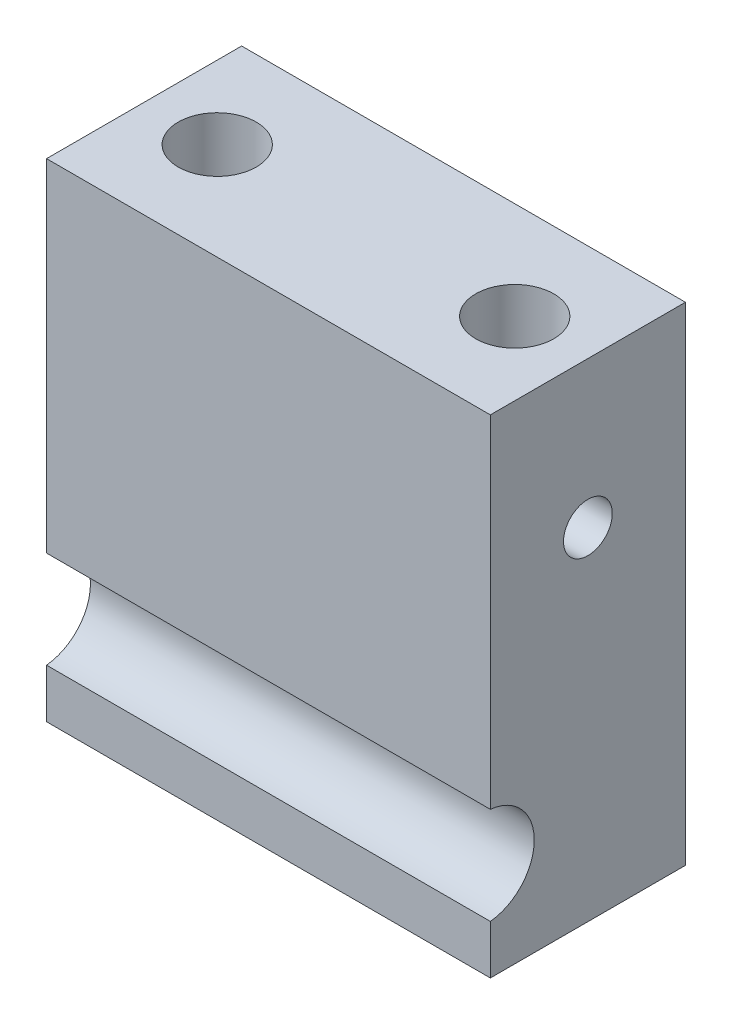
from build123d import *

# Parameters (mm, degrees)
SKETCH_1_W          = 9.1
SKETCH_1_H          = 4
EXTRUDE_1_DEPTH     = 10
SKETCH_2_R          = 0.5
SKETCH_2_R_2        = 1
CUT_EXTRUDE_1_DEPTH = 14.667845478
SKETCH_3_R          = 0.8
CUT_EXTRUDE_2_DEPTH = 2


with BuildPart() as part:
    # 草图1 → 凸台-拉伸1 (new body)
    with BuildSketch(Plane(origin=(0, 0, 0), x_dir=(1, 0, 0), z_dir=(0, 1, 0))):
        Rectangle(SKETCH_1_W, SKETCH_1_H)
    extrude(amount=EXTRUDE_1_DEPTH)

    # 草图2 → 切除-拉伸1 (cut, through all)
    with BuildSketch(Plane.ZY.offset(4.55)):
        with Locations((0, 7)):
            Circle(SKETCH_2_R)
        with Locations((2.1, 2)):
            Circle(SKETCH_2_R_2)
    extrude(amount=-CUT_EXTRUDE_1_DEPTH, mode=Mode.SUBTRACT)

    # 草图3 → 切除-拉伸2 (cut)
    with BuildSketch(Plane(origin=(0, 10, 0), x_dir=(1, 0, 0), z_dir=(0, 1, 0))):
        with Locations((3.05, 0)):
            Circle(SKETCH_3_R)
        with Locations((-3.05, 0)):
            Circle(SKETCH_3_R)
    extrude(amount=-CUT_EXTRUDE_2_DEPTH, mode=Mode.SUBTRACT)


solid = part.part
